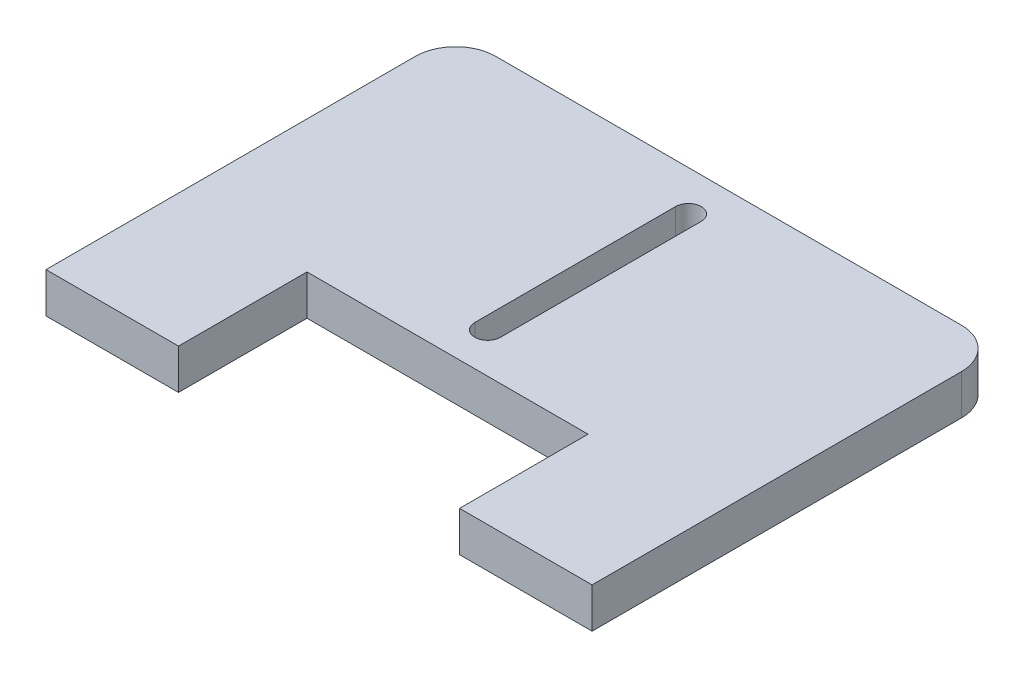
from build123d import *

# Parameters (mm, degrees)
EXTRUDE_1_DEPTH = 5
SKETCH_2_W      = 4
SKETCH_2_H      = 28
EXTRUDE_2_DEPTH = 5
FILLET_1_R      = 5


with BuildPart() as part:
    # 草图1 → 凸台-拉伸1 (new body)
    with BuildSketch(Plane(origin=(0, 0, 0), x_dir=(1, 0, 0), z_dir=(0, 1, 0))):
        Polygon((30, 22.84905584), (-30, 22.84905584), (-30, -5.15094416), (-34, -5.15094416), (-34, -28.15094416), (-17.5, -28.15094416), (-17.5, -12.15094416), (17.5, -12.15094416), (17.5, -28.15094416), (34, -28.15094416), (34, -5.15094416), (30, -5.15094416), align=None)
        with BuildLine():
            Line((1.6, 17.84905584), (1.6, -7.15094416))
            ThreePointArc((1.6, -7.15094416), (0, -8.75094416), (-1.6, -7.15094416))
            Line((-1.6, -7.15094416), (-1.6, 17.84905584))
            ThreePointArc((-1.6, 17.84905584), (0, 19.44905584), (1.6, 17.84905584))
        make_face(mode=Mode.SUBTRACT)
    extrude(amount=EXTRUDE_1_DEPTH)

    # 草图2 → 凸台-拉伸2 (add)
    with BuildSketch(Plane(origin=(0, 0, 0), x_dir=(1, 0, 0), z_dir=(0, 1, 0))):
        with Locations((-32, 8.84905584)):
            Rectangle(SKETCH_2_W, SKETCH_2_H)
        with Locations((32, 8.84905584)):
            Rectangle(SKETCH_2_W, SKETCH_2_H)
    extrude(amount=EXTRUDE_2_DEPTH)

    # 圆角1
    fillet_1_edges = [part.edges().sort_by_distance(p)[0] for p in [
        (-34, 2.5, -22.84905584),
        (34, 2.5, -22.84905584),
    ]]
    fillet(fillet_1_edges, radius=FILLET_1_R)


solid = part.part
